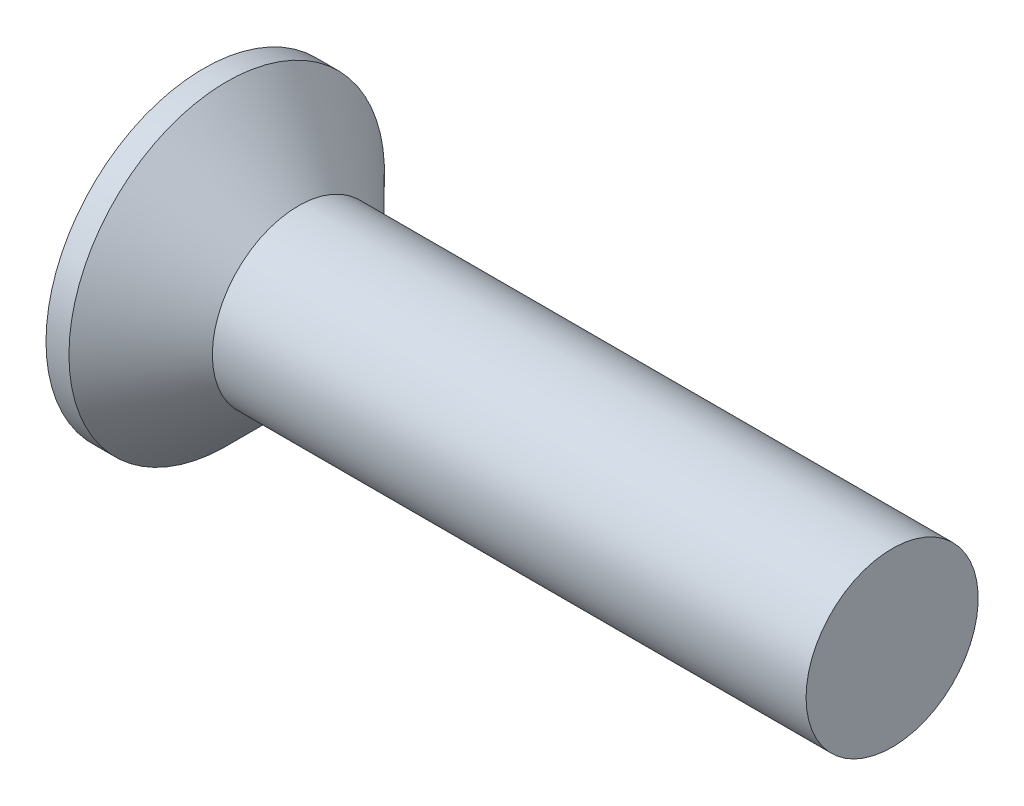
from build123d import *


with BuildPart() as part:
    # Esquisse1 → Révolution1 (revolve)
    with BuildSketch(Plane.XY, mode=Mode.PRIVATE) as r_volution1_sk:
        Polygon((0, 0), (12, 0), (12, 1.5), (1.65, 1.5), (0.4, 2.75), (0, 2.75), align=None)
    revolve(r_volution1_sk.sketch.rotate(Axis((0, 0, 0), (1, 0, 0)), 90), axis=Axis((0, 0, 0), (1, 0, 0)))


solid = part.part
